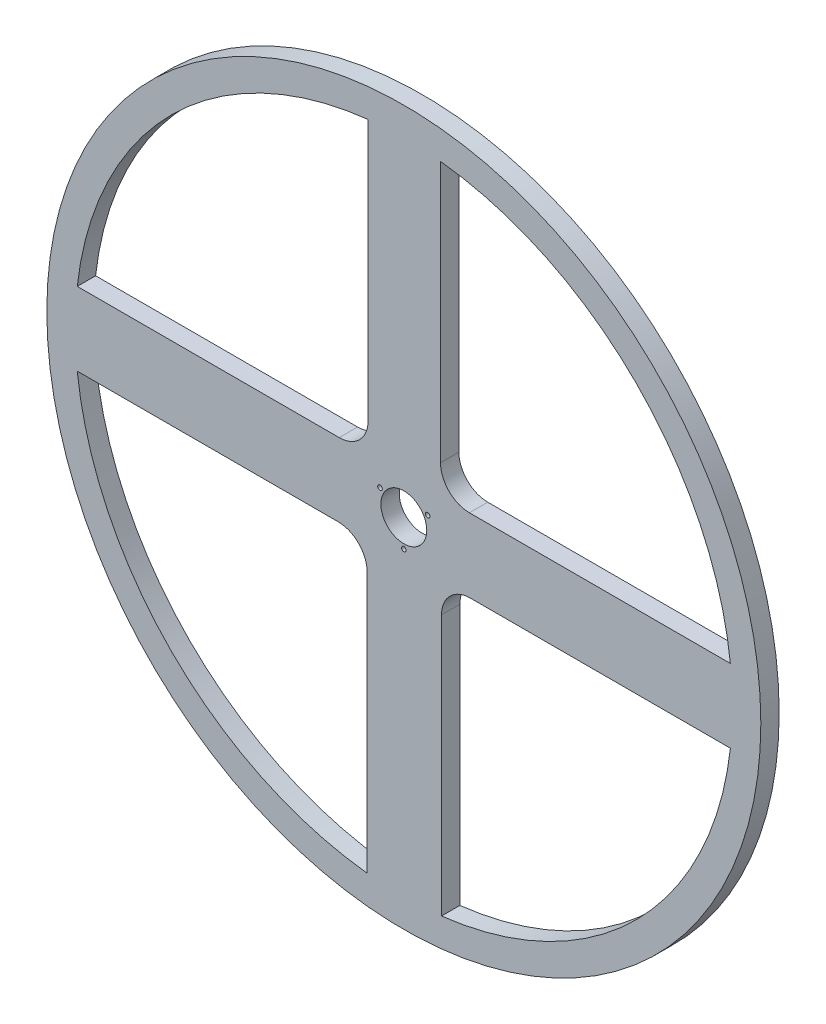
from build123d import *

# Parameters (mm, degrees)
SKETCH1_R           = 123.5325
SKETCH1_R_2         = 113.71
BOSS_EXTRUDE1_DEPTH = 6.35
CUT_EXTRUDE1_REACH  = 176.817
SKETCH2_R           = 7.937515
CUT_EXTRUDE2_REACH  = 176.817
SKETCH3_R           = 0.79375


with BuildPart() as part:
    # Sketch1 → Boss-Extrude1 (new body)
    # profile 1 of 2: a face of its own
    with BuildSketch(Plane.XY):
        Circle(SKETCH1_R)
        Circle(SKETCH1_R_2, mode=Mode.SUBTRACT)
    # profile 2 of 2: a face of its own
    with BuildSketch(Plane.XY):
        with BuildLine():
            ThreePointArc((22.7, 12.7), (15.628932188, 15.628932188), (12.7, 22.7))
            Line((12.7, 22.7), (12.7, 112.998557955))
            ThreePointArc((12.7, 112.998557955), (0.173278497, 113.709867974), (-12.355552704, 113.036739237))
            Line((-12.355552704, 113.036739237), (-12.355552704, 22.7))
            ThreePointArc((-12.355552704, 22.7), (-15.284484892, 15.628932188), (-22.355552704, 12.7))
            Line((-22.355552704, 12.7), (-112.998557955, 12.7))
            ThreePointArc((-112.998557955, 12.7), (-113.71, 0), (-112.998557955, -12.7))
            Line((-112.998557955, -12.7), (-22.7, -12.7))
            ThreePointArc((-22.7, -12.7), (-15.628932188, -15.628932188), (-12.7, -22.7))
            Line((-12.7, -22.7), (-12.7, -112.998557955))
            ThreePointArc((-12.7, -112.998557955), (0.173337872, -113.709867883), (13.044447296, -112.959313448))
            Line((13.044447296, -112.959313448), (13.044447296, -22.7))
            ThreePointArc((13.044447296, -22.7), (15.973379485, -15.628932188), (23.044447296, -12.7))
            Line((23.044447296, -12.7), (112.998557955, -12.7))
            ThreePointArc((112.998557955, -12.7), (113.53200017, -6.359955774), (113.71, 0))
            ThreePointArc((113.71, 0), (113.53200017, 6.359955774), (112.998557955, 12.7))
            Line((112.998557955, 12.7), (22.7, 12.7))
        make_face()
    extrude(amount=BOSS_EXTRUDE1_DEPTH)

    # Sketch2 → Cut-Extrude1 (cut, up to next)
    with BuildSketch(Plane.XY.offset(6.35), mode=Mode.PRIVATE) as cut_extrude1_sk1:
        Circle(SKETCH2_R)
    cut_extrude1_tool1 = extrude(cut_extrude1_sk1.sketch, amount=-CUT_EXTRUDE1_REACH, mode=Mode.PRIVATE) & part.part
    add(cut_extrude1_tool1.solids().sort_by_distance((0, 0, 6.35))[0], mode=Mode.SUBTRACT)

    # Sketch3 → Cut-Extrude2 (cut, up to next)
    with BuildSketch(Plane.XY.offset(6.35), mode=Mode.PRIVATE) as cut_extrude2_sk1:
        with Locations((0, -9.525)):
            Circle(SKETCH3_R)
    cut_extrude2_tool1 = extrude(cut_extrude2_sk1.sketch, amount=-CUT_EXTRUDE2_REACH, mode=Mode.PRIVATE) & part.part
    # Sketch3 → Cut-Extrude2 (cut, up to next)
    with BuildSketch(Plane.XY.offset(6.35), mode=Mode.PRIVATE) as cut_extrude2_sk2:
        with Locations((8.248891971, 4.7625)):
            Circle(SKETCH3_R)
    cut_extrude2_tool2 = extrude(cut_extrude2_sk2.sketch, amount=-CUT_EXTRUDE2_REACH, mode=Mode.PRIVATE) & part.part
    # Sketch3 → Cut-Extrude2 (cut, up to next)
    with BuildSketch(Plane.XY.offset(6.35), mode=Mode.PRIVATE) as cut_extrude2_sk3:
        with Locations((-8.248891971, 4.7625)):
            Circle(SKETCH3_R)
    cut_extrude2_tool3 = extrude(cut_extrude2_sk3.sketch, amount=-CUT_EXTRUDE2_REACH, mode=Mode.PRIVATE) & part.part
    add(cut_extrude2_tool1.solids().sort_by_distance((0, -9.525, 6.35))[0], mode=Mode.SUBTRACT)
    add(cut_extrude2_tool2.solids().sort_by_distance((8.248892, 4.7625, 6.35))[0], mode=Mode.SUBTRACT)
    add(cut_extrude2_tool3.solids().sort_by_distance((-8.248892, 4.7625, 6.35))[0], mode=Mode.SUBTRACT)


solid = part.part
